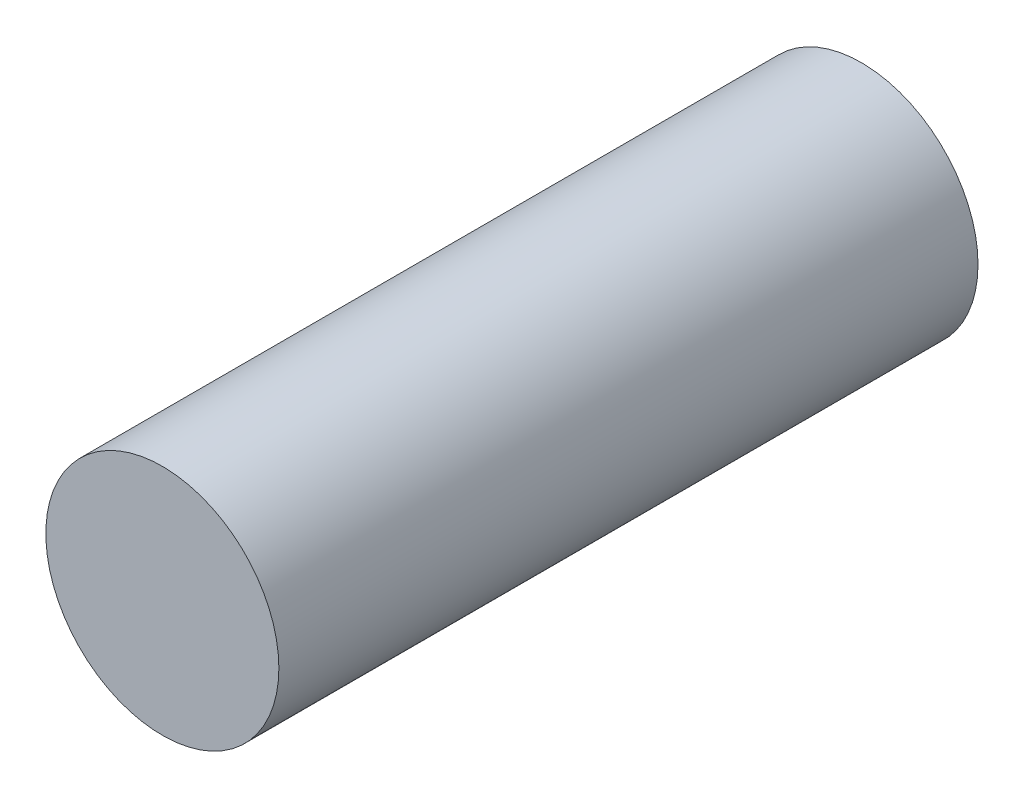
from build123d import *

# Parameters (mm, degrees)
SKETCH1_R           = 5
BOSS_EXTRUDE1_DEPTH = 15


with BuildPart() as part:
    # Sketch1 → Boss-Extrude1 (new, symmetric)
    with BuildSketch(Plane.XY):
        Circle(SKETCH1_R)
    extrude(amount=BOSS_EXTRUDE1_DEPTH, both=True)


solid = part.part
